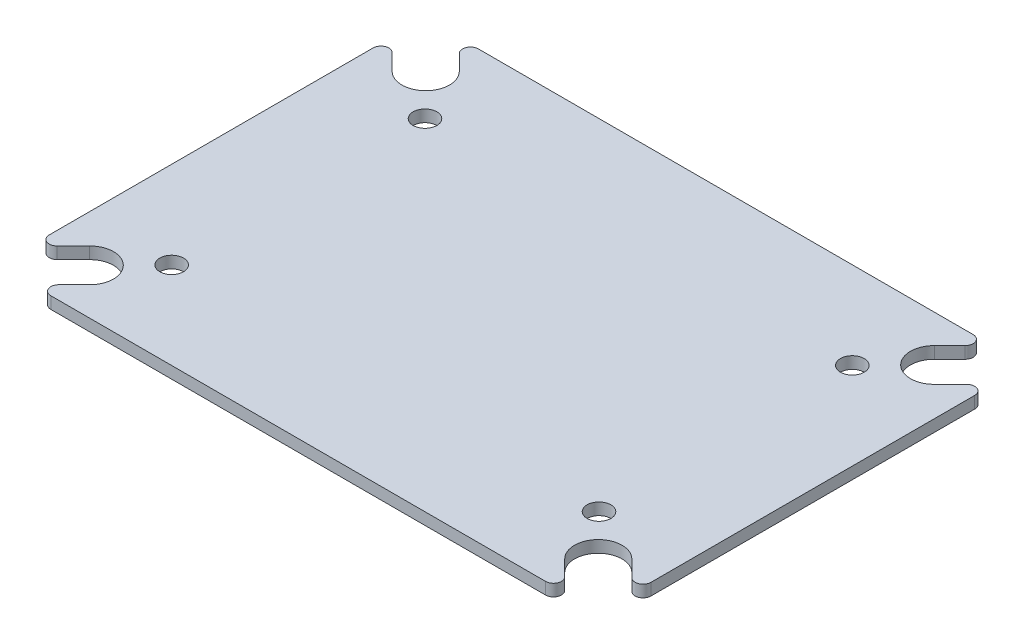
from build123d import *

# Parameters (mm, degrees)
SKETCH1_R           = 1.5
BOSS_EXTRUDE1_DEPTH = 1.5


with BuildPart() as part:
    # Sketch1 → Boss-Extrude1 (new body)
    with BuildSketch(Plane(origin=(0, 0, 0), x_dir=(1, 0, 0), z_dir=(0, 1, 0))):
        with BuildLine():
            Line((6.755042478, -2), (69.244957522, -2))
            ThreePointArc((69.244957522, -2), (70.169022091, -2.617763592), (69.951379765, -3.707790657))
            Line((69.951379765, -3.707790657), (67.996333944, -5.65905667))
            ThreePointArc((67.996333944, -5.65905667), (67.993254266, -9.902722426), (72.236921016, -9.903748986))
            Line((72.236921016, -9.903748986), (74.292893219, -7.847776783))
            ThreePointArc((74.292893219, -7.847776783), (75.382683432, -7.631004031), (76, -8.554883564))
            Line((76, -8.554883564), (76, -49.445116436))
            ThreePointArc((76, -49.445116436), (75.382683432, -50.368995969), (74.292893219, -50.152223217))
            Line((74.292893219, -50.152223217), (72.236921016, -48.096251014))
            ThreePointArc((72.236921016, -48.096251014), (67.993254266, -48.097277574), (67.996333944, -52.34094333))
            Line((67.996333944, -52.34094333), (69.951379765, -54.292209343))
            ThreePointArc((69.951379765, -54.292209343), (70.169022091, -55.382236408), (69.244957522, -56))
            Line((69.244957522, -56), (6.755042478, -56))
            ThreePointArc((6.755042478, -56), (5.830977909, -55.382236408), (6.048620235, -54.292209343))
            Line((6.048620235, -54.292209343), (8.003666056, -52.34094333))
            ThreePointArc((8.003666056, -52.34094333), (8.006745734, -48.097277574), (3.763078984, -48.096251014))
            Line((3.763078984, -48.096251014), (1.707106781, -50.152223217))
            ThreePointArc((1.707106781, -50.152223217), (0.617316568, -50.368995969), (0, -49.445116436))
            Line((0, -49.445116436), (0, -8.554883564))
            ThreePointArc((0, -8.554883564), (0.617316568, -7.631004031), (1.707106781, -7.847776783))
            Line((1.707106781, -7.847776783), (3.763078984, -9.903748986))
            ThreePointArc((3.763078984, -9.903748986), (8.006745734, -9.902722426), (8.003666056, -5.65905667))
            Line((8.003666056, -5.65905667), (6.048620235, -3.707790657))
            ThreePointArc((6.048620235, -3.707790657), (5.830977909, -2.617763592), (6.755042478, -2))
        make_face()
        with Locations(Location((11.0125, -13.001163208, 0), (0, 0, 270))):
            Circle(SKETCH1_R, mode=Mode.SUBTRACT)
        with Locations(Location((64.9875, -13.001163208, 0), (0, 0, 90))):
            Circle(SKETCH1_R, mode=Mode.SUBTRACT)
        with Locations(Location((64.9875, -44.998836792, 0), (0, 0, 270))):
            Circle(SKETCH1_R, mode=Mode.SUBTRACT)
        with Locations(Location((11.0125, -44.998836792, 0), (0, 0, 90))):
            Circle(SKETCH1_R, mode=Mode.SUBTRACT)
    extrude(amount=BOSS_EXTRUDE1_DEPTH)


solid = part.part
